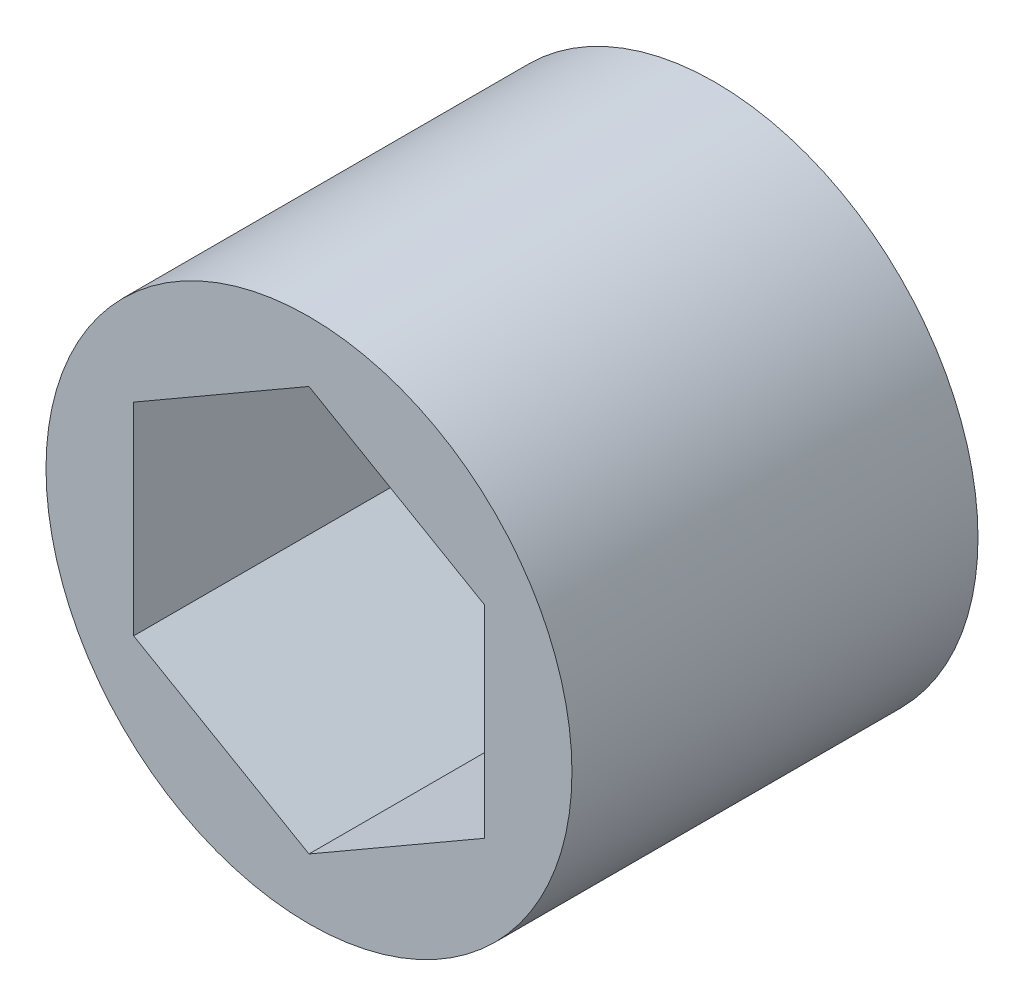
from build123d import *

# Parameters (mm, degrees)
SKETCH1_R           = 9.525
BOSS_EXTRUDE1_DEPTH = 7.3533


with BuildPart() as part:
    # Sketch1 → Boss-Extrude1 (new, symmetric)
    with BuildSketch(Plane.XY):
        with Locations(Location((0, 0, 0), (0, 0, 180))):
            Circle(SKETCH1_R)
        Polygon((0, 7.332348419), (-6.35, 3.666174209), (-6.35, -3.666174209), (0, -7.332348419), (6.35, -3.666174209), (6.35, 3.666174209), align=None, mode=Mode.SUBTRACT)
    extrude(amount=BOSS_EXTRUDE1_DEPTH, both=True)


solid = part.part
